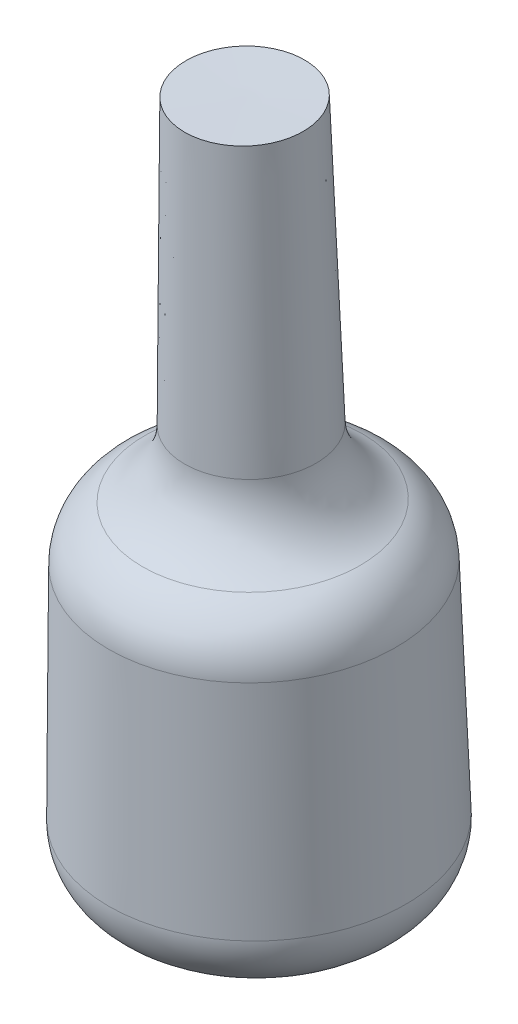
from build123d import *

# Parameters (mm, degrees)
FILLET1_R = 10
FILLET3_R = 10


with BuildPart() as part:
    # Sketch1 → Revolve1 (revolve)
    with BuildSketch(Plane(origin=(0, 0, 0), x_dir=(0, 0, -1), z_dir=(1, 0, 0))):
        with BuildLine():
            Line((-18.394691605, 55.313614898), (-15.803889971, -58.42257686))
            Line((-15.803889971, -58.42257686), (-40.675585663, -58.42257686))
            Line((-40.675585663, -58.42257686), (-40.675585663, -4.274822697))
            ThreePointArc((-40.675585663, -4.274822697), (-31.876602198, -0.630164411), (-28.231943912, 8.168819054))
            Line((-28.231943912, 8.168819054), (-28.231943912, 55.313614898))
            Line((-28.231943912, 55.313614898), (-18.394691605, 55.313614898))
        make_face()
    revolve(axis=Axis((0, 55.313614898, 18.394691605), (0, -0.9997406585155251, -0.02277313572928287)))

    # Fillet1
    fillet1_edges = [part.edges().sort_by_distance(p)[0] for p in [
        (0, -57.290057641, -9.042008017),
    ]]
    fillet(fillet1_edges, radius=FILLET1_R)

    # Fillet3
    fillet3_edges = [part.edges().sort_by_distance(p)[0] for p in [
        (0, -3.198467231, -6.576419302),
    ]]
    fillet(fillet3_edges, radius=FILLET3_R)


solid = part.part
